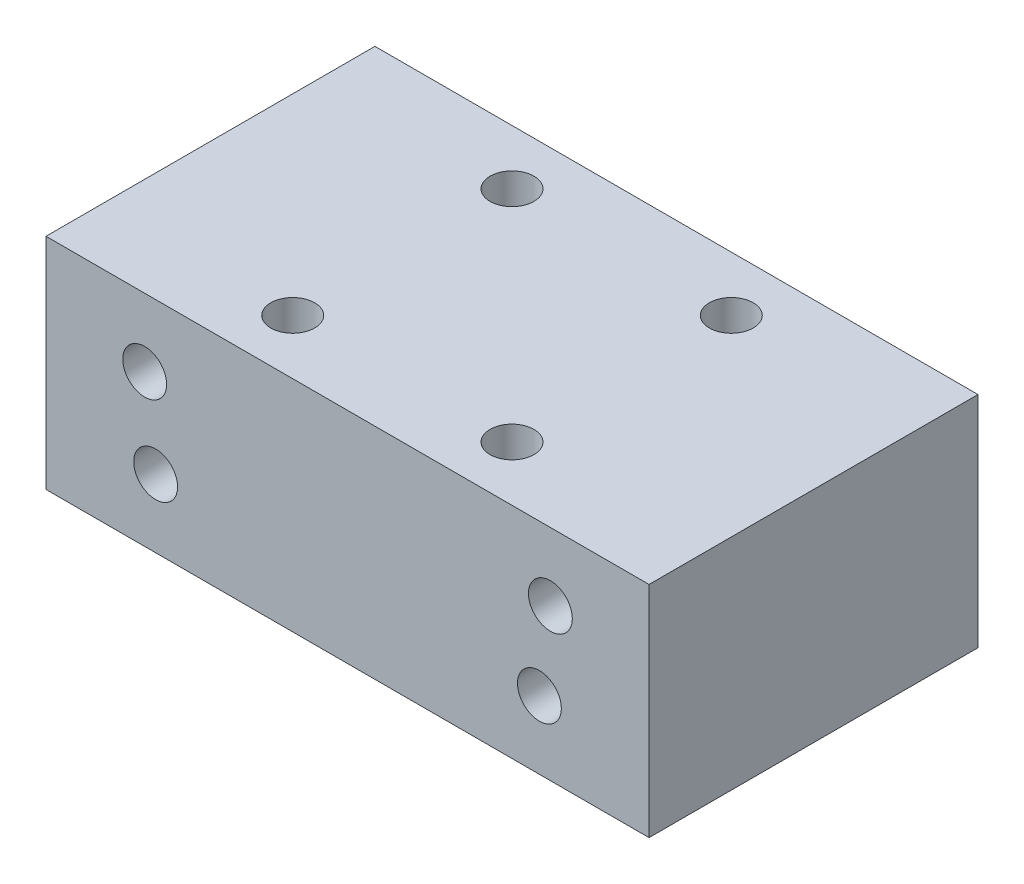
from build123d import *

# Parameters (mm, degrees)
SKETCH1_W                     = 139.7
SKETCH1_H                     = 50.8
BOSS_EXTRUDE1_DEPTH           = 38.1
F_0_4IN_DIAMETER_HOLE_ZAXIS_D = 10.16
F_0_4IN_DIAMETER_HOLE_YAXIS_D = 10.16


with BuildPart() as part:
    # Sketch1 → Boss-Extrude1 (new, symmetric)
    with BuildSketch(Plane.XY):
        Rectangle(SKETCH1_W, SKETCH1_H)
    extrude(amount=BOSS_EXTRUDE1_DEPTH, both=True)

    # 0.4in Diameter Hole zaxis (through all)
    with Locations(Plane.XY.offset(38.1)):
        with Locations((46.99, 9.652), (44.45, -9.652)):
            f_0_4in_diameter_hole_zaxis = Hole(F_0_4IN_DIAMETER_HOLE_ZAXIS_D / 2)

    # Mirror1: 0.4in Diameter Hole zaxis across plane
    add(f_0_4in_diameter_hole_zaxis.mirror(Plane(origin=(0, 0, 0), x_dir=(0, 0, 1), z_dir=(1, 0, 0))), mode=Mode.SUBTRACT)

    # 0.4in Diameter Hole yaxis (through all)
    with Locations(Plane(origin=(0, 25.4, 0), x_dir=(1, 0, 0), z_dir=(0, 1, 0))):
        with Locations((-25.4, 25.4), (-25.4, -25.4), (25.4, -25.4), (25.4, 25.4)):
            Hole(F_0_4IN_DIAMETER_HOLE_YAXIS_D / 2)


solid = part.part
